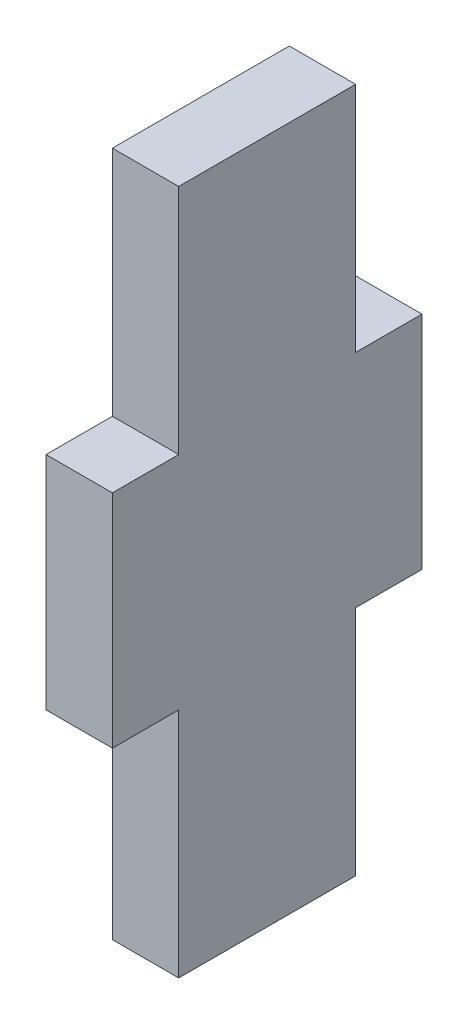
from build123d import *

# Parameters (mm, degrees)
ESQUISSE1_W          = 6
ESQUISSE1_H          = 20
BOSS_EXTRU_2_DEPTH   = 6
ESQUISSE1_W_2        = 16
ESQUISSE1_H_2        = 6
BOSS_EXTRU_2_2_DEPTH = 6
BOSS_EXTRU_2_3_DEPTH = 6
BOSS_EXTRU_2_4_DEPTH = 6
BOSS_EXTRU_3_DEPTH   = 16


with BuildPart() as part:
    # Esquisse1 → Boss.-Extru.2 (new body)
    with BuildSketch(Plane.ZY.offset(97.003078089)):
        with Locations((181.00005, -2.704155421)):
            Rectangle(ESQUISSE1_W, ESQUISSE1_H)
    extrude(amount=BOSS_EXTRU_2_DEPTH)



with BuildPart() as body_2:
    # Esquisse1 → Boss.-Extru.2 2 (new body)
    with BuildSketch(Plane.ZY.offset(97.003078089)):
        with Locations((192.00005, 25.295844579)):
            Rectangle(ESQUISSE1_W_2, ESQUISSE1_H_2)
    extrude(amount=BOSS_EXTRU_2_2_DEPTH)


with BuildPart() as body_3:
    # Esquisse1 → Boss.-Extru.2 3 (new body)
    with BuildSketch(Plane.ZY.offset(97.003078089)):
        with Locations((203.00005, -2.704155421)):
            Rectangle(ESQUISSE1_W, ESQUISSE1_H)
    extrude(amount=BOSS_EXTRU_2_3_DEPTH)


with BuildPart() as body_4:
    # Esquisse1 → Boss.-Extru.2 4 (new body)
    with BuildSketch(Plane.ZY.offset(97.003078089)):
        with Locations((192.00005, -30.704155421)):
            Rectangle(ESQUISSE1_W_2, ESQUISSE1_H_2)
    extrude(amount=BOSS_EXTRU_2_4_DEPTH)


with BuildPart() as part_1:
    add(part.part)

    add(body_2.part)  # Boss.-Extru.3 merges body 2

    add(body_3.part)  # Boss.-Extru.3 merges body 3

    add(body_4.part)  # Boss.-Extru.3 merges body 4
    # Esquisse2 → Boss.-Extru.3 (add)
    with BuildSketch(Plane(origin=(0, 0, 200.00005), x_dir=(-1, 0, 0), z_dir=(0, 0, -1))):
        Polygon((103.003078089, 22.295844579), (97.003078089, 22.295844579), (97.003078089, 7.295844579), (97.003078089, -12.704155421), (97.003078089, -27.704155421), (103.003078089, -27.704155421), (103.003078089, -12.704155421), (103.003078089, 7.295844579), align=None)
    extrude(amount=BOSS_EXTRU_3_DEPTH)


solid = part_1.part
